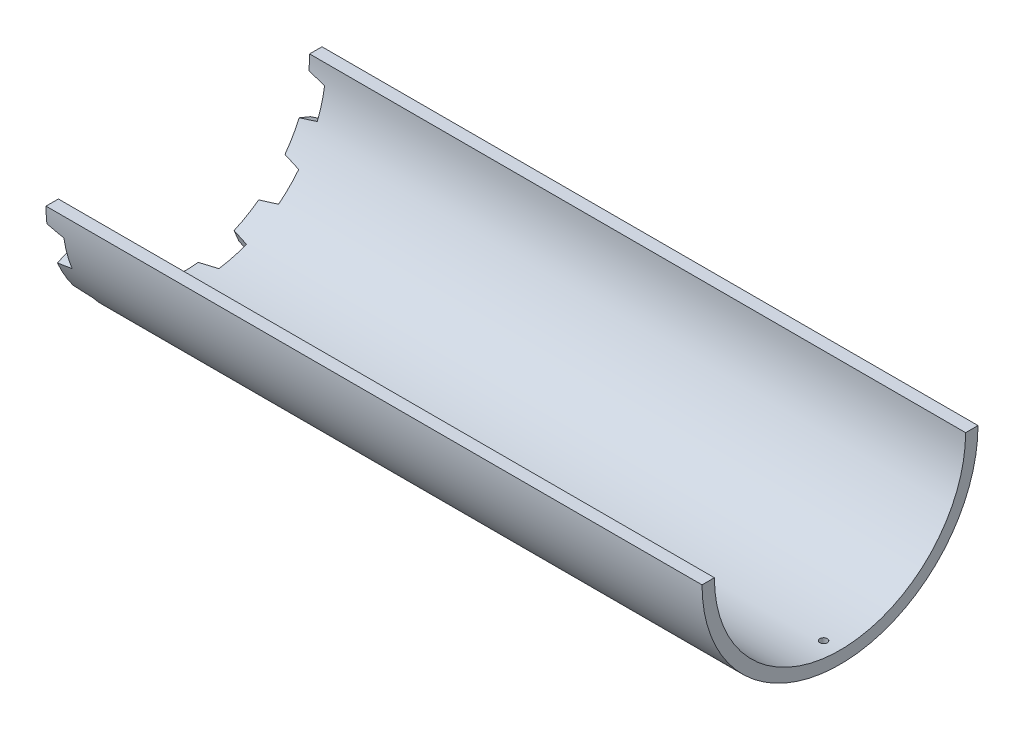
from build123d import *
from build123d.topology import SkipClean

# Parameters (mm, degrees)
SKETCH1_W                                           = 390
SKETCH1_H                                           = 7.5438
BOSS_EXTRUDE1_DEPTH                                 = 5
DRAFT1_ANGLE                                        = -15
CIRPATTERN1_COUNT                                   = 12
DRAFT1_OF_CIRPATTERN1_2_ANGLE                       = -15
DRAFT1_OF_CIRPATTERN1_3_ANGLE                       = -15
DRAFT1_OF_CIRPATTERN1_4_ANGLE                       = -15
DRAFT1_OF_CIRPATTERN1_5_ANGLE                       = -15
DRAFT1_OF_CIRPATTERN1_6_ANGLE                       = -15
DRAFT1_OF_CIRPATTERN1_7_ANGLE                       = -15
DRAFT1_OF_CIRPATTERN1_8_ANGLE                       = -15
DRAFT1_OF_CIRPATTERN1_9_ANGLE                       = -15
DRAFT1_OF_CIRPATTERN1_10_ANGLE                      = -15
DRAFT1_OF_CIRPATTERN1_11_ANGLE                      = -15
DRAFT1_OF_CIRPATTERN1_12_ANGLE                      = -15
CUT_EXTRUDE1_DEPTH                                  = 563.723944588
CSK_FOR_M4_COUNTERSUNK_FLAT_HEAD_SCREW1_D           = 4.5
CSK_FOR_M4_COUNTERSUNK_FLAT_HEAD_SCREW1_CSINK_D     = 9.4
CSK_FOR_M4_COUNTERSUNK_FLAT_HEAD_SCREW1_CSINK_ANGLE = 90


with BuildPart() as part:
    # Sketch1 → Revolve1 (revolve)
    with BuildSketch(Plane.XY, mode=Mode.PRIVATE) as revolve1_sk:
        with Locations((355, 80.3656)):
            Rectangle(SKETCH1_W, SKETCH1_H)
    revolve(revolve1_sk.sketch.rotate(Axis((0, 0, 0), (1, 0, 0)), 90), axis=Axis((0, 0, 0), (1, 0, 0)))

    # Sketch2 → Boss-Extrude1 (add, symmetric)
    with BuildSketch(Plane(origin=(155, 0, 0), x_dir=(0, 0, -1), z_dir=(1, 0, 0))):
        with BuildLine():
            Line((9.997484009, 75.938430279), (10.982147498, 83.417692024))
            ThreePointArc((10.982147498, 83.417692024), (0, 84.1375), (-10.982147498, 83.417692024))
            Line((-10.982147498, 83.417692024), (-9.997484009, 75.938430279))
            ThreePointArc((-9.997484009, 75.938430279), (0, 76.5937), (9.997484009, 75.938430279))
        make_face()
    boss_extrude1 = extrude(amount=BOSS_EXTRUDE1_DEPTH, both=True)

    # Draft1
    draft1_faces = [part.faces().sort_by_distance(p)[0] for p in [
        (155, 79.678061151, 10.489815753),
        (155, 79.678061151, -10.489815753),
    ]]
    draft(draft1_faces, Plane(origin=(155, 0, 0), x_dir=(0, 0, 1), z_dir=(1, 0, 0)), DRAFT1_ANGLE)

    # CirPattern1: Boss-Extrude1 ×12 about axis
    with SkipClean():  # the faces are left unmerged after this step: merging them gives an invalid solid
        cirpattern1_axis = Axis((0, 0, 0), (1, 0, 0))
        for i in range(1, CIRPATTERN1_COUNT):
            add(boss_extrude1.rotate(cirpattern1_axis, i * 360 / CIRPATTERN1_COUNT))

    # Draft1 of CirPattern1 2
    draft1_of_cirpattern1_2_faces = [part.faces().sort_by_distance(p)[0] for p in [
        (155, 63.758317205, 48.923477499),
        (155, 74.248132958, 30.754583652),
    ]]
    draft(draft1_of_cirpattern1_2_faces, Plane(origin=(155, 0, 0), x_dir=(0, -0.49999999999999994, 0.8660254037844387), z_dir=(1, 0, 0)), DRAFT1_OF_CIRPATTERN1_2_ANGLE)

    # Draft1 of CirPattern1 3
    draft1_of_cirpattern1_3_faces = [part.faces().sort_by_distance(p)[0] for p in [
        (155, 30.754583652, 74.248132958),
        (155, 48.923477499, 63.758317205),
    ]]
    draft(draft1_of_cirpattern1_3_faces, Plane(origin=(155, 0, 0), x_dir=(0, -0.8660254037844386, 0.5000000000000001), z_dir=(1, 0, 0)), DRAFT1_OF_CIRPATTERN1_3_ANGLE)

    # Draft1 of CirPattern1 4
    draft1_of_cirpattern1_4_faces = [part.faces().sort_by_distance(p)[0] for p in [
        (155, -10.489815753, 79.678061151),
        (155, 10.489815753, 79.678061151),
    ]]
    draft(draft1_of_cirpattern1_4_faces, Plane(origin=(155, 0, 0), x_dir=(0, -1, 0), z_dir=(1, 0, 0)), DRAFT1_OF_CIRPATTERN1_4_ANGLE)

    # Draft1 of CirPattern1 5
    draft1_of_cirpattern1_5_faces = [part.faces().sort_by_distance(p)[0] for p in [
        (155, -48.923477499, 63.758317205),
        (155, -30.754583652, 74.248132958),
    ]]
    draft(draft1_of_cirpattern1_5_faces, Plane(origin=(155, 0, 0), x_dir=(0, -0.8660254037844387, -0.4999999999999998), z_dir=(1, 0, 0)), DRAFT1_OF_CIRPATTERN1_5_ANGLE)

    # Draft1 of CirPattern1 6
    draft1_of_cirpattern1_6_faces = [part.faces().sort_by_distance(p)[0] for p in [
        (155, -74.248132958, 30.754583652),
        (155, -63.758317205, 48.923477499),
    ]]
    draft(draft1_of_cirpattern1_6_faces, Plane(origin=(155, 0, 0), x_dir=(0, -0.49999999999999994, -0.8660254037844387), z_dir=(1, 0, 0)), DRAFT1_OF_CIRPATTERN1_6_ANGLE)

    # Draft1 of CirPattern1 7
    draft1_of_cirpattern1_7_faces = [part.faces().sort_by_distance(p)[0] for p in [
        (155, -79.678061151, -10.489815753),
        (155, -79.678061151, 10.489815753),
    ]]
    draft(draft1_of_cirpattern1_7_faces, Plane(origin=(155, 0, 0), x_dir=(0, 0, -1), z_dir=(1, 0, 0)), DRAFT1_OF_CIRPATTERN1_7_ANGLE)

    # Draft1 of CirPattern1 8
    draft1_of_cirpattern1_8_faces = [part.faces().sort_by_distance(p)[0] for p in [
        (155, -63.758317205, -48.923477499),
        (155, -74.248132958, -30.754583652),
    ]]
    draft(draft1_of_cirpattern1_8_faces, Plane(origin=(155, 0, 0), x_dir=(0, 0.5000000000000001, -0.8660254037844386), z_dir=(1, 0, 0)), DRAFT1_OF_CIRPATTERN1_8_ANGLE)

    # Draft1 of CirPattern1 9
    draft1_of_cirpattern1_9_faces = [part.faces().sort_by_distance(p)[0] for p in [
        (155, -30.754583652, -74.248132958),
        (155, -48.923477499, -63.758317205),
    ]]
    draft(draft1_of_cirpattern1_9_faces, Plane(origin=(155, 0, 0), x_dir=(0, 0.8660254037844384, -0.5000000000000004), z_dir=(1, 0, 0)), DRAFT1_OF_CIRPATTERN1_9_ANGLE)

    # Draft1 of CirPattern1 10
    draft1_of_cirpattern1_10_faces = [part.faces().sort_by_distance(p)[0] for p in [
        (155, 10.489815753, -79.678061151),
        (155, -10.489815753, -79.678061151),
    ]]
    draft(draft1_of_cirpattern1_10_faces, Plane.YZ.offset(155), DRAFT1_OF_CIRPATTERN1_10_ANGLE)

    # Draft1 of CirPattern1 11
    draft1_of_cirpattern1_11_faces = [part.faces().sort_by_distance(p)[0] for p in [
        (155, 48.923477499, -63.758317205),
        (155, 30.754583652, -74.248132958),
    ]]
    draft(draft1_of_cirpattern1_11_faces, Plane(origin=(155, 0, 0), x_dir=(0, 0.8660254037844386, 0.5000000000000001), z_dir=(1, 0, 0)), DRAFT1_OF_CIRPATTERN1_11_ANGLE)

    # Draft1 of CirPattern1 12
    draft1_of_cirpattern1_12_faces = [part.faces().sort_by_distance(p)[0] for p in [
        (155, 74.248132958, -30.754583652),
        (155, 63.758317205, -48.923477499),
    ]]
    draft(draft1_of_cirpattern1_12_faces, Plane(origin=(155, 0, 0), x_dir=(0, 0.5000000000000004, 0.8660254037844384), z_dir=(1, 0, 0)), DRAFT1_OF_CIRPATTERN1_12_ANGLE)

    # Sketch3 → Cut-Extrude1 (cut, through all)
    with BuildSketch(Plane(origin=(0, 0, 0), x_dir=(0, 0, -1), z_dir=(1, 0, 0))):
        with BuildLine():
            Line((0, 0), (-84.1375, 0))
            ThreePointArc((-84.1375, 0), (0, 84.1375), (84.1375, 0))
            Line((84.1375, 0), (0, 0))
        make_face()
    extrude(amount=CUT_EXTRUDE1_DEPTH, mode=Mode.SUBTRACT)

    # CSK for M4 Countersunk Flat Head Screw1 (through all)
    with Locations(Plane(origin=(540, -84.1375, 0), x_dir=(0, 0, -1), z_dir=(0, -1, 0))):
        with Locations((0, 0)):
            CounterSinkHole(CSK_FOR_M4_COUNTERSUNK_FLAT_HEAD_SCREW1_D / 2, CSK_FOR_M4_COUNTERSUNK_FLAT_HEAD_SCREW1_CSINK_D / 2, counter_sink_angle=CSK_FOR_M4_COUNTERSUNK_FLAT_HEAD_SCREW1_CSINK_ANGLE)


solid = part.part
